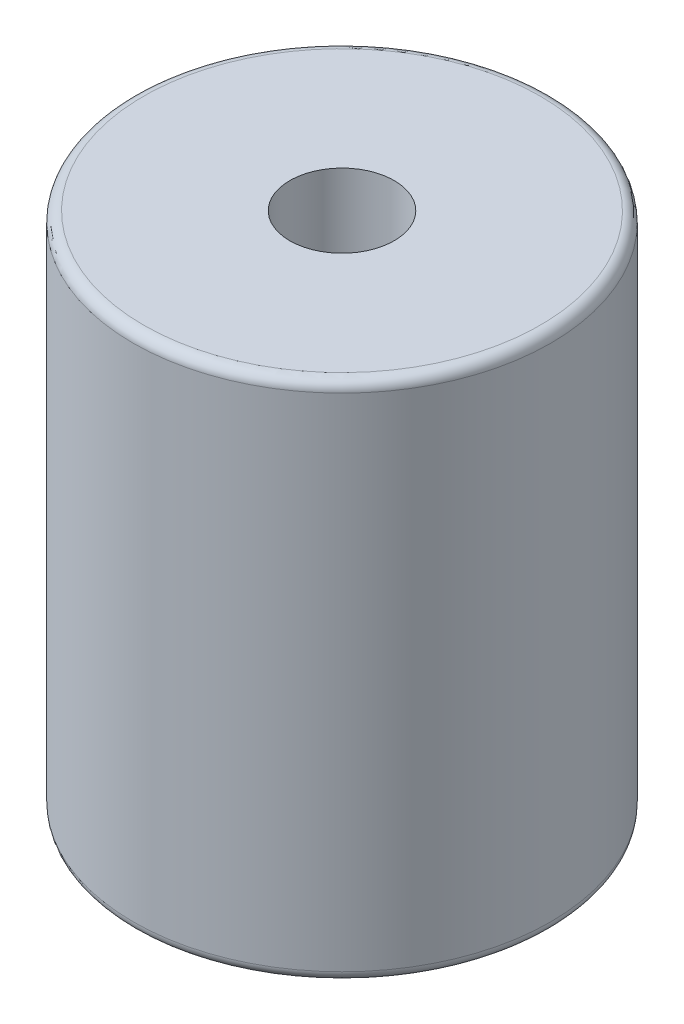
from build123d import *

# Parameters (mm, degrees)
SKETCH1_R           = 10
BOSS_EXTRUDE1_DEPTH = 25
FILLET2_R           = 0.5
FILLET3_R           = 0.5
SKETCH2_R           = 4
CUT_EXTRUDE1_DEPTH  = 12.5
SKETCH3_R           = 2.5
CUT_EXTRUDE2_DEPTH  = 12.5


with BuildPart() as part:
    # Sketch1 → Boss-Extrude1 (new body)
    with BuildSketch(Plane(origin=(0, 0, 0), x_dir=(1, 0, 0), z_dir=(0, 1, 0))):
        with Locations(Location((0, 0, 0), (0, 0, 270))):
            Circle(SKETCH1_R)
    extrude(amount=BOSS_EXTRUDE1_DEPTH)

    # Fillet2
    fillet2_edges = [part.edges().sort_by_distance(p)[0] for p in [
        (0, 25, -10),
    ]]
    fillet(fillet2_edges, radius=FILLET2_R)

    # Fillet3
    fillet3_edges = [part.edges().sort_by_distance(p)[0] for p in [
        (0, 0, -10),
    ]]
    fillet(fillet3_edges, radius=FILLET3_R)

    # Sketch2 → Cut-Extrude1 (cut)
    with BuildSketch(Plane.XZ):
        with Locations(Location((0, 0, 0), (0, 0, 270))):
            Circle(SKETCH2_R)
    extrude(amount=-CUT_EXTRUDE1_DEPTH, mode=Mode.SUBTRACT)

    # Sketch3 → Cut-Extrude2 (cut)
    with BuildSketch(Plane(origin=(0, 25, 0), x_dir=(1, 0, 0), z_dir=(0, 1, 0))):
        with Locations(Location((0, 0, 0), (0, 0, 270))):
            Circle(SKETCH3_R)
    extrude(amount=-CUT_EXTRUDE2_DEPTH, mode=Mode.SUBTRACT)


solid = part.part
